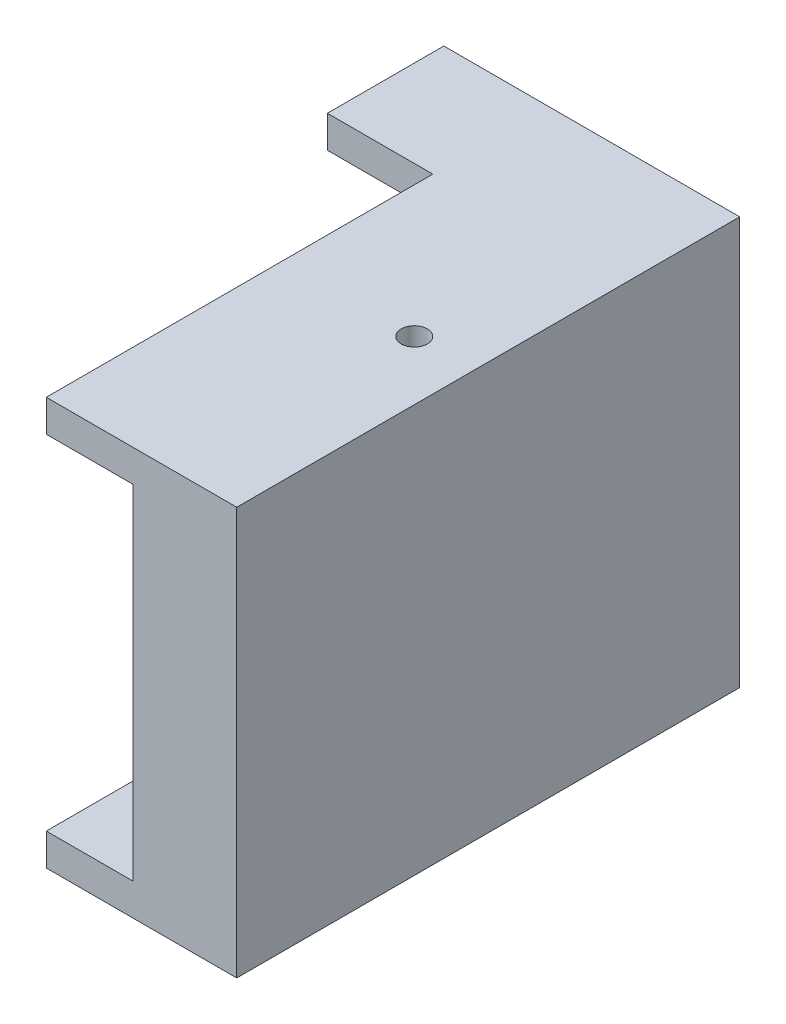
from build123d import *

# Parameters (mm, degrees)
BOSS_EXTRUDE1_DEPTH = 70
SKETCH2_W           = 79
SKETCH2_H           = 59
CUT_EXTRUDE1_DEPTH  = 33.02
SKETCH3_R           = 2.2479
CUT_EXTRUDE2_DEPTH  = 123.22393219


with BuildPart() as part:
    # Sketch1 → Boss-Extrude1 (new body)
    with BuildSketch(Plane(origin=(0, 0, 0), x_dir=(1, 0, 0), z_dir=(0, 1, 0))):
        Polygon((-50.8, -20), (-32.7, -20), (-32.7, -86.36), (0, -86.36), (0, 0), (-50.8, 0), align=None)
    extrude(amount=BOSS_EXTRUDE1_DEPTH)

    # Sketch2 → Cut-Extrude1 (cut)
    with BuildSketch(Plane.ZY.offset(50.8)):
        with Locations((46.86, 35)):
            Rectangle(SKETCH2_W, SKETCH2_H)
    extrude(amount=-CUT_EXTRUDE1_DEPTH, mode=Mode.SUBTRACT)

    # Sketch3 → Cut-Extrude2 (cut, through all)
    with BuildSketch(Plane(origin=(0, 70, 0), x_dir=(1, 0, 0), z_dir=(0, 1, 0))):
        with Locations(Location((-10.16, -45.72, 0), (0, 0, 270))):
            Circle(SKETCH3_R)
    extrude(amount=-CUT_EXTRUDE2_DEPTH, mode=Mode.SUBTRACT)


solid = part.part
